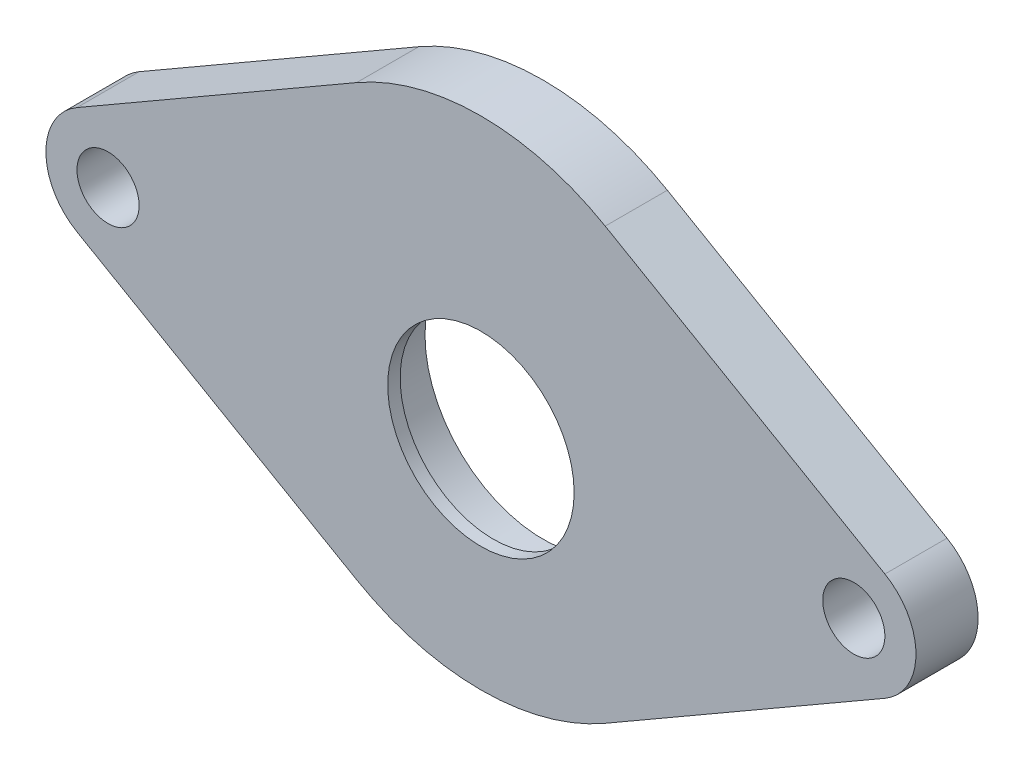
from build123d import *

# Parameters (mm, degrees)
BOSS_EXTRUDE1_DEPTH = 10
SKETCH1_3_R         = 15
SKETCH1_3_R_2       = 5
CUT_EXTRUDE1_DEPTH  = 10
SKETCH1_4_R         = 19
CUT_EXTRUDE2_DEPTH  = 8


with BuildPart() as part:
    # Sketch1 → Boss-Extrude1 (new body)
    with BuildSketch(Plane.XY):
        with BuildLine():
            Line((-20, 99.641016151), (-65, 73.660254038))
            ThreePointArc((-65, 73.660254038), (-70, 65), (-65, 56.339745962))
            Line((-65, 56.339745962), (-20, 30.358983849))
            ThreePointArc((-20, 30.358983849), (0, 25), (20, 30.358983849))
            Line((20, 30.358983849), (65, 56.339745962))
            ThreePointArc((65, 56.339745962), (70, 65), (65, 73.660254038))
            Line((65, 73.660254038), (20, 99.641016151))
            ThreePointArc((20, 99.641016151), (0, 105), (-20, 99.641016151))
        make_face()
    extrude(amount=BOSS_EXTRUDE1_DEPTH)

    # Sketch1<3> → Cut-Extrude1 (cut)
    with BuildSketch(Plane.XY):
        with Locations((0, 60)):
            Circle(SKETCH1_3_R)
        with Locations((-60, 65)):
            Circle(SKETCH1_3_R_2)
        with Locations((60, 65)):
            Circle(SKETCH1_3_R_2)
    extrude(amount=CUT_EXTRUDE1_DEPTH, mode=Mode.SUBTRACT)

    # Sketch1<4> → Cut-Extrude2 (cut)
    with BuildSketch(Plane.XY):
        with Locations((0, 60)):
            Circle(SKETCH1_4_R)
    extrude(amount=CUT_EXTRUDE2_DEPTH, mode=Mode.SUBTRACT)


solid = part.part
